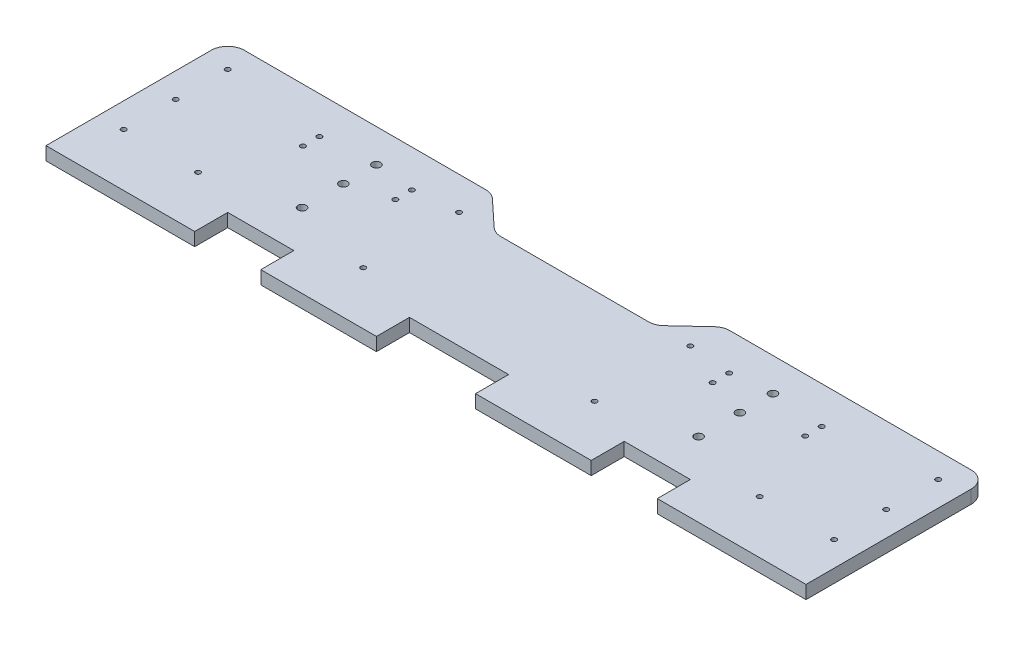
from build123d import *

# Parameters (mm, degrees)
SKETCH_2_W          = 460
SKETCH_2_H          = 110
EXTRUDE_1_DEPTH     = 8
SKETCH_4_R          = 1.5
CUT_EXTRUDE_1_DEPTH = 237.619948441
SKETCH_3_R          = 2.5
SKETCH_3_R_2        = 1.5
CUT_EXTRUDE_2_DEPTH = 237.619948441
FILLET_1_R          = 10
SKETCH_5_W          = 60
SKETCH_5_H          = 20
SKETCH_5_W_2        = 40
CUT_EXTRUDE_3_DEPTH = 237.619948441


with BuildPart() as part:
    # 草图2 → 凸台-拉伸1 (new body)
    with BuildSketch(Plane(origin=(0, 0, 0), x_dir=(1, 0, 0), z_dir=(0, 1, 0))):
        Rectangle(SKETCH_2_W, SKETCH_2_H)
    extrude(amount=EXTRUDE_1_DEPTH)

    # 草图4 → 切除-拉伸1 (cut, through all)
    with BuildSketch(Plane(origin=(0, 8, 0), x_dir=(1, 0, 0), z_dir=(0, 1, 0))):
        with Locations(Location((-70, 35, 0), (0, 0, 270))):
            Circle(SKETCH_4_R)
        with Locations(Location((-70, -23, 0), (0, 0, 270))):
            Circle(SKETCH_4_R)
        with Locations(Location((-215, -23, 0), (0, 0, 270))):
            Circle(SKETCH_4_R)
        with Locations(Location((-215, 40, 0), (0, 0, 270))):
            Circle(SKETCH_4_R)
        with Locations(Location((-170, -23, 0), (0, 0, 270))):
            Circle(SKETCH_4_R)
        with Locations(Location((-215, 8.5, 0), (0, 0, 270))):
            Circle(SKETCH_4_R)
    cut_extrude_1 = extrude(amount=-CUT_EXTRUDE_1_DEPTH, mode=Mode.SUBTRACT)

    # 草图3 → 切除-拉伸2 (cut, through all)
    with BuildSketch(Plane(origin=(0, 8, 0), x_dir=(1, 0, 0), z_dir=(0, 1, 0))):
        with Locations(Location((-120, 35, 0), (0, 0, 270))):
            Circle(SKETCH_3_R)
        with Locations(Location((-120, 15, 0), (0, 0, 270))):
            Circle(SKETCH_3_R)
        with Locations(Location((-152, 32.5, 0), (0, 0, 270))):
            Circle(SKETCH_3_R_2)
        with Locations(Location((-152, 22.5, 0), (0, 0, 270))):
            Circle(SKETCH_3_R_2)
        with Locations(Location((-96, 32.5, 0), (0, 0, 270))):
            Circle(SKETCH_3_R_2)
        with Locations(Location((-96, 22.5, 0), (0, 0, 270))):
            Circle(SKETCH_3_R_2)
        with Locations(Location((-120, -10, 0), (0, 0, 270))):
            Circle(SKETCH_3_R)
        Polygon((-70, 55), (-48.5526258, 35), (48.5526258, 35), (70, 55), align=None)
    cut_extrude_2 = extrude(amount=-CUT_EXTRUDE_2_DEPTH, mode=Mode.SUBTRACT)

    # 镜向1: 切除-拉伸1, 切除-拉伸2 across plane
    add(cut_extrude_1.mirror(Plane(origin=(0, 0, 0), x_dir=(0, 0, 1), z_dir=(1, 0, 0))), mode=Mode.SUBTRACT)
    add(cut_extrude_2.mirror(Plane(origin=(0, 0, 0), x_dir=(0, 0, 1), z_dir=(1, 0, 0))), mode=Mode.SUBTRACT)

    # 圆角1
    fillet_1_edges = [part.edges().sort_by_distance(p)[0] for p in [
        (-70, 4, -55),
        (70, 4, -55),
        (48.5526258, 4, -35),
        (-48.5526258, 4, -35),
        (-230, 4, -55),
        (230, 4, -55),
    ]]
    fillet(fillet_1_edges, radius=FILLET_1_R)

    # 草图5 → 切除-拉伸3 (cut, through all)
    with BuildSketch(Plane(origin=(0, 8, 0), x_dir=(1, 0, 0), z_dir=(0, 1, 0))):
        with Locations((0, -45)):
            Rectangle(SKETCH_5_W, SKETCH_5_H)
        with Locations((120, -45)):
            Rectangle(SKETCH_5_W_2, SKETCH_5_H)
    cut_extrude_3 = extrude(amount=-CUT_EXTRUDE_3_DEPTH, mode=Mode.SUBTRACT)

    # 镜向2: 切除-拉伸3 across plane
    add(cut_extrude_3.mirror(Plane(origin=(0, 0, 0), x_dir=(0, 0, 1), z_dir=(1, 0, 0))), mode=Mode.SUBTRACT)


solid = part.part
